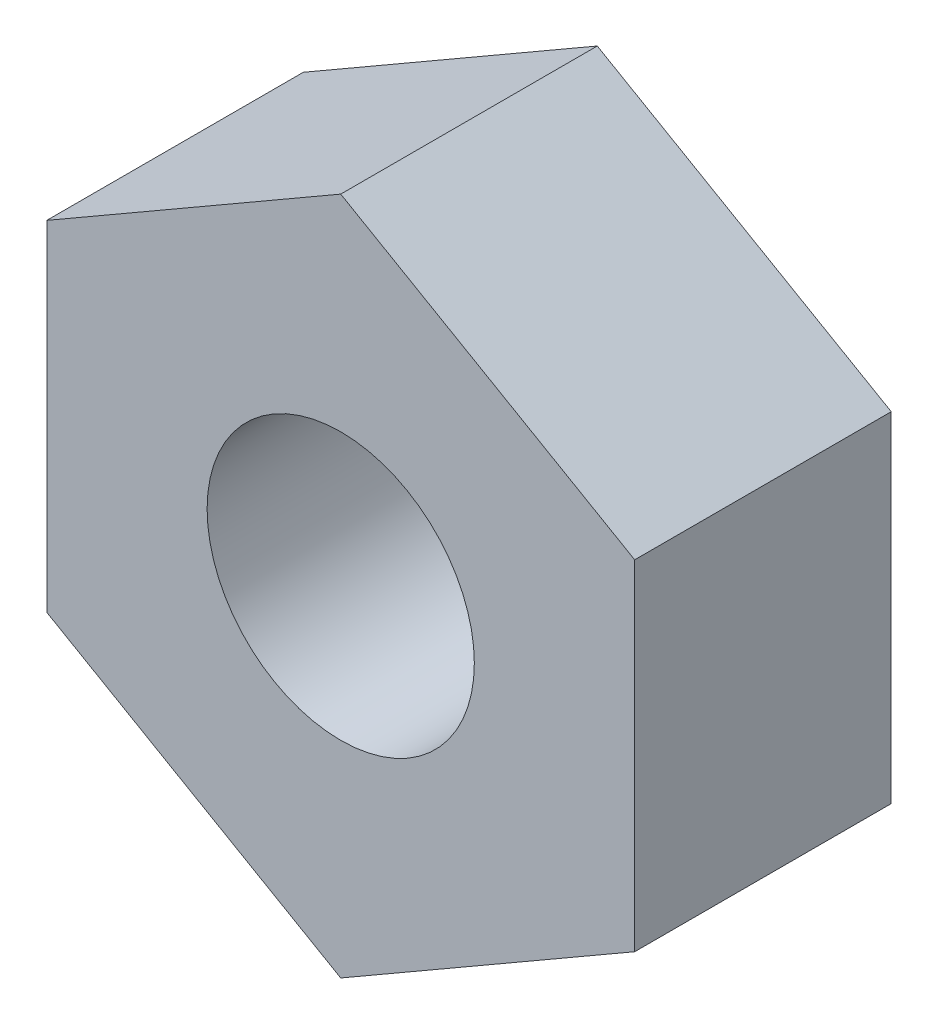
from build123d import *

# Parameters (mm, degrees)
PROFILE_1_R   = 1.25
HEX_NUT_DEPTH = 2.4


with BuildPart() as part:
    # Profile_1 → Hex_nut (new body)
    with BuildSketch(Plane.XY):
        Polygon((2.75, 1.58771324), (0, 3.175426481), (-2.75, 1.58771324), (-2.75, -1.58771324), (0, -3.175426481), (2.75, -1.58771324), align=None)
        Circle(PROFILE_1_R, mode=Mode.SUBTRACT)
    extrude(amount=HEX_NUT_DEPTH)


solid = part.part
